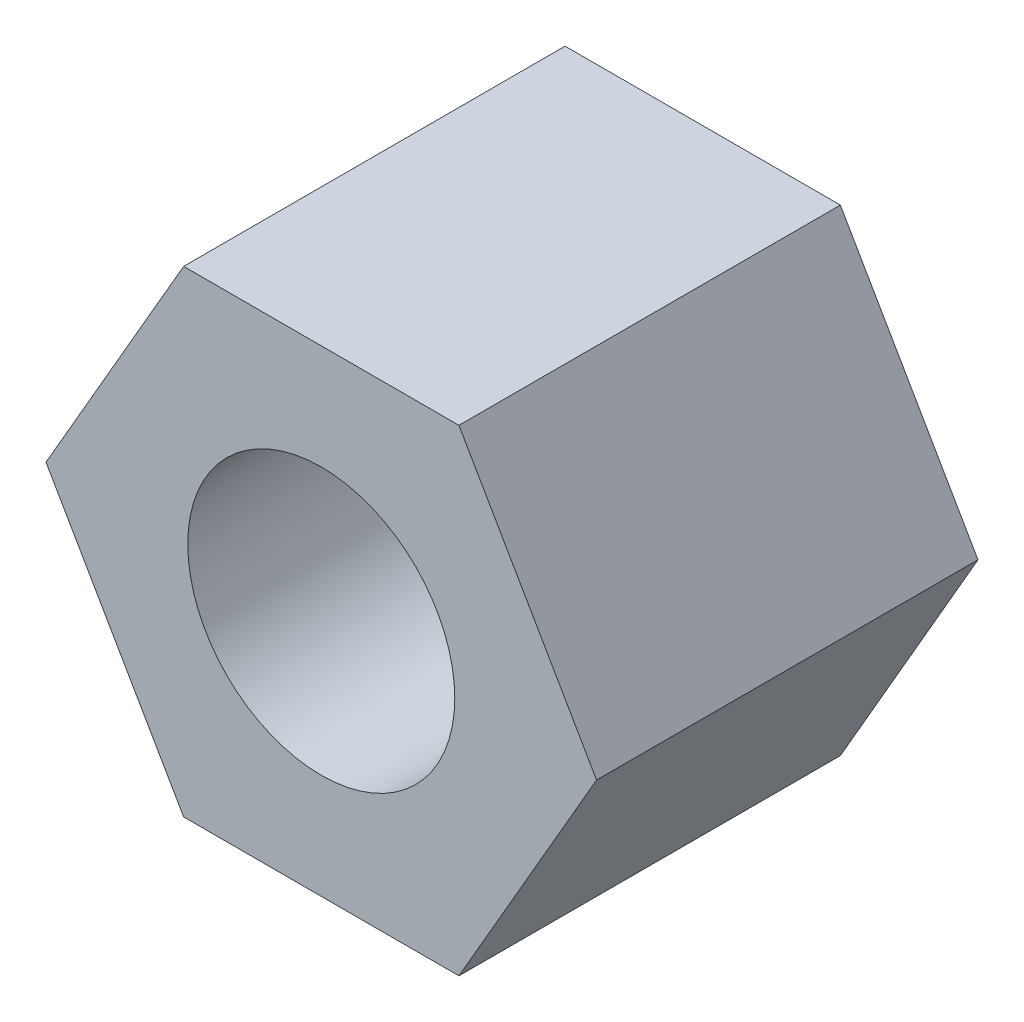
from build123d import *

# Parameters (mm, degrees)
CROQUIS1_R              = 1.4
SALIENTE_EXTRUIR1_DEPTH = 4


with BuildPart() as part:
    # Croquis1 → Saliente-Extruir1 (new body)
    with BuildSketch(Plane.XY):
        Polygon((2.886751346, 0), (1.443375673, 2.5), (-1.443375673, 2.5), (-2.886751346, 0), (-1.443375673, -2.5), (1.443375673, -2.5), align=None)
        Circle(CROQUIS1_R, mode=Mode.SUBTRACT)
    extrude(amount=SALIENTE_EXTRUIR1_DEPTH)


solid = part.part
